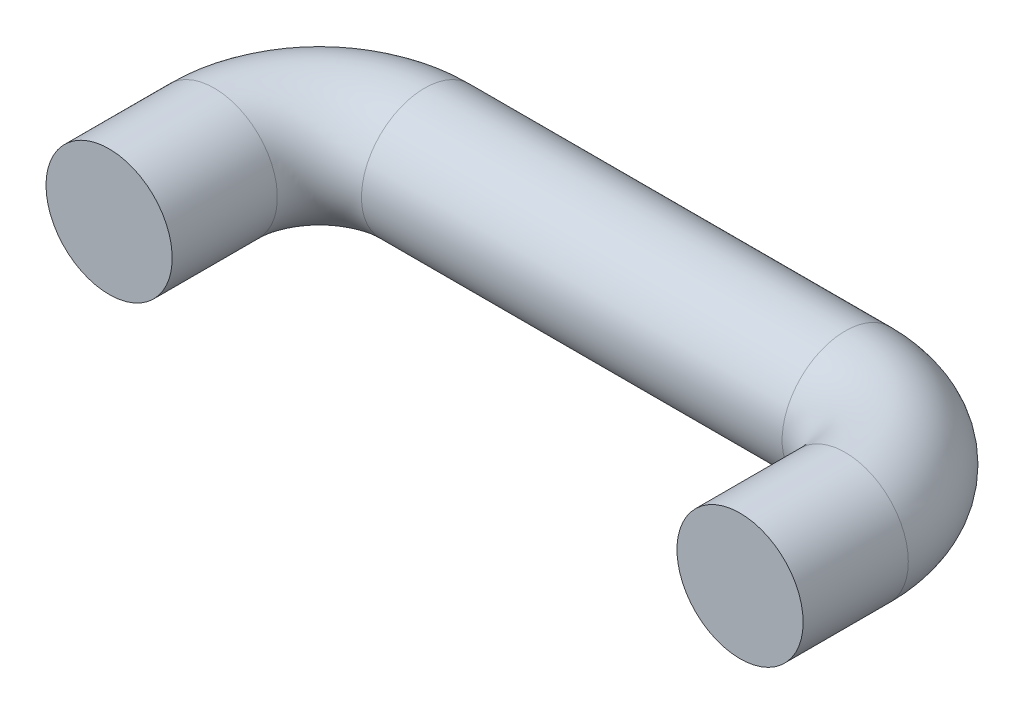
from build123d import *

# Parameters (mm, degrees)
SZKIC2_R = 3


with BuildPart() as part:
    # Wyciągnięcie po ścieżce1: sweep along a path in Szkic1
    with BuildLine(Plane(origin=(0, 0, 0), x_dir=(1, 0, 0), z_dir=(0, 1, 0))) as wyci_gni_cie_po_cie_ce1_path:
        Line((-60, -25), (-60, -20))
        ThreePointArc((-60, -20), (-58.535533906, -16.464466094), (-55, -15))
        Line((-55, -15), (-35, -15))
        ThreePointArc((-35, -15), (-31.464466094, -16.464466094), (-30, -20))
        Line((-30, -20), (-30, -25))
    # Szkic2 → Wyciągnięcie po ścieżce1 (sweep)
    with BuildSketch(Plane(origin=(-60, 0, 25), x_dir=(-1, 0, 0), z_dir=(0, 0, -1))):
        Circle(SZKIC2_R)
    sweep(path=wyci_gni_cie_po_cie_ce1_path.line)


solid = part.part
